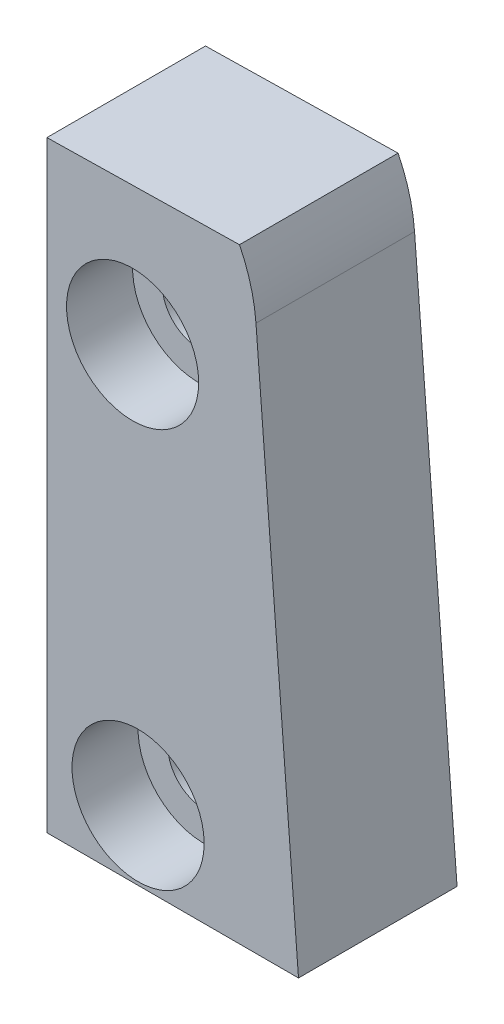
from build123d import *

# Parameters (mm, degrees)
BOSS_EXTRUDE1_DEPTH = 1.8
SKETCH3_R           = 1.1
BOSS_EXTRUDE2_DEPTH = 3
SKETCH4_W           = 3.5
SKETCH4_H           = 7.184629835
CUT_EXTRUDE1_DEPTH  = 2
SKETCH5_R           = 2
CUT_EXTRUDE2_DEPTH  = 2


with BuildPart() as part:
    # Sketch1 → Boss-Extrude1 (new body)
    with BuildSketch(Plane(origin=(0, 0, 0), x_dir=(0, 1, 0), z_dir=(0, 0, 1))):
        with BuildLine():
            Line((6.830014349, -2.344806069), (-9.690684049, -3.631823148))
            Line((-9.690684049, -3.631823148), (-9.690684049, -2.205416312))
            Line((-9.690684049, -2.205416312), (6.947514193, -1.975901922))
            Line((6.947514193, -1.975901922), (7.350857331, -1.970338035))
            Line((7.350857331, -1.970338035), (7.269057374, 3.9595904))
            Line((7.269057374, 3.9595904), (8.531793523, 3.982646507))
            Line((8.531793523, 3.982646507), (8.638213972, -1.845785322))
            ThreePointArc((8.638213972, -1.845785322), (7.758081535, -2.182141378), (6.830014349, -2.344806069))
        make_face()
    extrude(amount=BOSS_EXTRUDE1_DEPTH)

    # Sketch3 → Boss-Extrude2 (add)
    with BuildSketch(Plane.XY.offset(1.8)):
        with BuildLine():
            Line((-3.982646507, 8.531793523), (-3.982646507, -9.690684049))
            Line((-3.982646507, -9.690684049), (3.631823148, -9.690684049))
            Line((3.631823148, -9.690684049), (2.344806069, 6.830014349))
            ThreePointArc((2.344806069, 6.830014349), (2.182141378, 7.758081535), (1.845785322, 8.638213972))
            Line((1.845785322, 8.638213972), (-3.982646507, 8.531793523))
        make_face()
        with Locations((-1.223821134, -7.594621825)):
            Circle(SKETCH3_R, mode=Mode.SUBTRACT)
        with Locations((-1.389338495, 4.404236621)):
            Circle(SKETCH3_R, mode=Mode.SUBTRACT)
    extrude(amount=BOSS_EXTRUDE2_DEPTH)

    # Sketch4 → Cut-Extrude1 (cut)
    with BuildSketch(Plane(origin=(0, 0, 1.8), x_dir=(1, 0, 0), z_dir=(0, 0, -1))):
        with Locations((-1.203567216, 1.607597674)):
            Rectangle(SKETCH4_W, SKETCH4_H)
    extrude(amount=-CUT_EXTRUDE1_DEPTH, mode=Mode.SUBTRACT)

    # Sketch5 → Cut-Extrude2 (cut)
    with BuildSketch(Plane.XY.offset(4.8)):
        with Locations((-1.389338495, 4.404236621)):
            Circle(SKETCH5_R)
        with Locations((-1.223821134, -7.594621825)):
            Circle(SKETCH5_R)
    extrude(amount=-CUT_EXTRUDE2_DEPTH, mode=Mode.SUBTRACT)


solid = part.part
